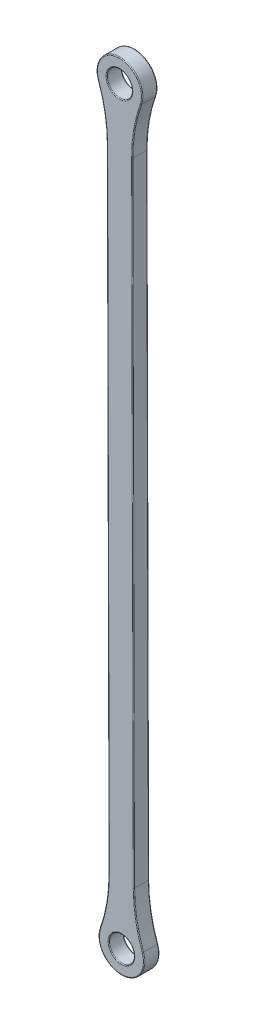
from build123d import *

# Parameters (mm, degrees)
BOSS_EXTRUDE1_DEPTH = 3
FILLET1_R           = 30
FILLET2_R           = 0.15


with BuildPart() as part:
    # Sketch1 → Boss-Extrude1 (new body)
    with BuildSketch(Plane.XY):
        with BuildLine():
            ThreePointArc((18.60751735, 229.499479574), (11.980936647, 233.465290274), (11.617448679, 225.75120557))
            Line((11.617448679, 225.75120557), (11.607526141, 229.4928498))
            ThreePointArc((11.607526141, 229.4928498), (14.100887576, 231.999470783), (16.60750856, 229.506109348))
            Line((16.60750856, 229.506109348), (16.617431097, 225.764465118))
            ThreePointArc((16.617431097, 225.764465118), (18.078953606, 227.38342332), (18.60751735, 229.499479574))
        make_face()
        with BuildLine():
            Line((11.617448679, 225.75120557), (11.990086237, 85.235014445))
            ThreePointArc((11.990086237, 85.235014445), (14.48806639, 85.999984166), (16.990068655, 85.248273993))
            Line((16.990068655, 85.248273993), (16.617431097, 225.764465118))
            ThreePointArc((16.617431097, 225.764465118), (14.119450944, 224.999495398), (11.617448679, 225.75120557))
        make_face()
        with BuildLine():
            Line((11.607526141, 229.4928498), (11.617448679, 225.75120557))
            ThreePointArc((11.617448679, 225.75120557), (14.119450944, 224.999495398), (16.617431097, 225.764465118))
            Line((16.617431097, 225.764465118), (16.60750856, 229.506109348))
            ThreePointArc((16.60750856, 229.506109348), (14.114147125, 226.999488365), (11.607526141, 229.4928498))
        make_face()
        with BuildLine():
            Line((11.990086237, 85.235014445), (12.000008774, 81.493370215))
            ThreePointArc((12.000008774, 81.493370215), (14.493370209, 83.999991198), (16.999991193, 81.506629763))
            Line((16.999991193, 81.506629763), (16.990068655, 85.248273993))
            ThreePointArc((16.990068655, 85.248273993), (14.48806639, 85.999984166), (11.990086237, 85.235014445))
        make_face()
        with BuildLine():
            ThreePointArc((16.999991193, 81.506629763), (14.506629758, 79.00000878), (12.000008774, 81.493370215))
            Line((12.000008774, 81.493370215), (11.990086237, 85.235014445))
            ThreePointArc((11.990086237, 85.235014445), (12.383943729, 77.528563734), (18.999999983, 81.499999989))
            ThreePointArc((18.999999983, 81.499999989), (18.465810684, 83.626580693), (16.990068655, 85.248273993))
            Line((16.990068655, 85.248273993), (16.999991193, 81.506629763))
        make_face()
    extrude(amount=-BOSS_EXTRUDE1_DEPTH)

    # Fillet1
    fillet1_edges = [part.edges().sort_by_distance(p)[0] for p in [
        (11.617448679, 225.75120557, -1.5),
        (16.617431097, 225.764465118, -1.5),
        (16.990068655, 85.248273993, -1.5),
        (11.990086237, 85.235014445, -1.5),
    ]]
    fillet(fillet1_edges, radius=FILLET1_R)

    # Fillet2
    fillet2_edges = [part.edges().sort_by_distance(p)[0] for p in [
        (13.73974947, 77.064684988, 0),
        (11.607526141, 229.4928498, -3),
        (13.73974947, 77.064684988, -3),
        (16.803749876, 155.506369556, 0),
        (16.803749876, 155.506369556, -3),
        (11.803767458, 155.493110007, 0),
        (11.803767458, 155.493110007, -3),
        (16.999991193, 81.506629763, -3),
        (14.095583757, 233.999463751, 0),
        (14.095583757, 233.999463751, -3),
        (17.420816024, 87.97606622, 0),
        (17.420816024, 87.97606622, -3),
        (11.54487726, 87.960483706, 0),
        (11.54487726, 87.960483706, -3),
        (11.18670131, 223.023413344, 0),
        (11.18670131, 223.023413344, -3),
        (17.062640073, 223.038995857, 0),
        (17.062640073, 223.038995857, -3),
        (16.999991193, 81.506629763, 0),
        (11.607526141, 229.4928498, 0),
    ]]
    fillet(fillet2_edges, radius=FILLET2_R)


solid = part.part
